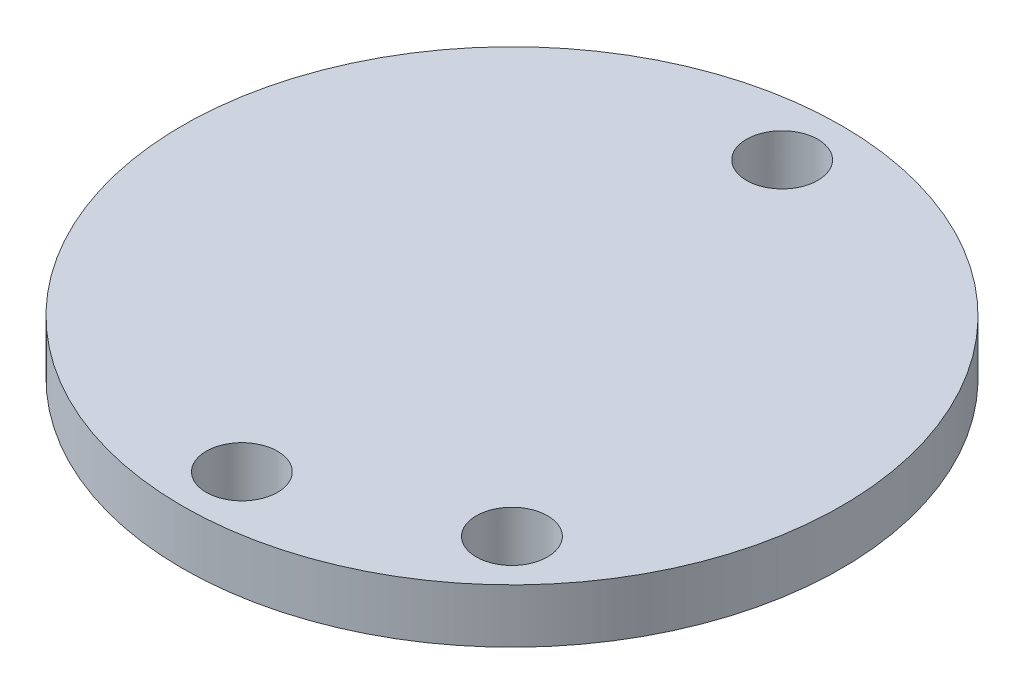
from build123d import *

# Parameters (mm, degrees)
SKETCH1_R           = 30.5
BOSS_EXTRUDE1_DEPTH = 5
SKETCH4_R           = 3.302
CUT_EXTRUDE2_DEPTH  = 5.08
SKETCH5_R           = 3.302
CUT_EXTRUDE3_DEPTH  = 5.08
SKETCH6_R           = 3.302
CUT_EXTRUDE4_DEPTH  = 5.08


with BuildPart() as part:
    # Sketch1 → Boss-Extrude1 (new body)
    with BuildSketch(Plane(origin=(0, 0, 0), x_dir=(1, 0, 0), z_dir=(0, 1, 0))):
        with Locations(Location((0, 0, 0), (0, 0, 270))):
            Circle(SKETCH1_R)
    extrude(amount=BOSS_EXTRUDE1_DEPTH)

    # Sketch4 → Cut-Extrude2 (cut)
    with BuildSketch(Plane(origin=(0, 0, 0), x_dir=(-1, 0, 0), z_dir=(0, -1, 0))):
        with Locations(Location((0, 25, 0), (0, 0, 90))):
            Circle(SKETCH4_R)
    extrude(amount=-CUT_EXTRUDE2_DEPTH, mode=Mode.SUBTRACT)

    # Sketch5 → Cut-Extrude3 (cut)
    with BuildSketch(Plane.XZ):
        with Locations(Location((0, 25, 0), (0, 0, 270))):
            Circle(SKETCH5_R)
    extrude(amount=-CUT_EXTRUDE3_DEPTH, mode=Mode.SUBTRACT)

    # Sketch6 → Cut-Extrude4 (cut)
    with BuildSketch(Plane.XZ):
        with Locations(Location((17.674476483, 17.680862, 0), (0, 0, 270))):
            Circle(SKETCH6_R)
    extrude(amount=-CUT_EXTRUDE4_DEPTH, mode=Mode.SUBTRACT)


solid = part.part
